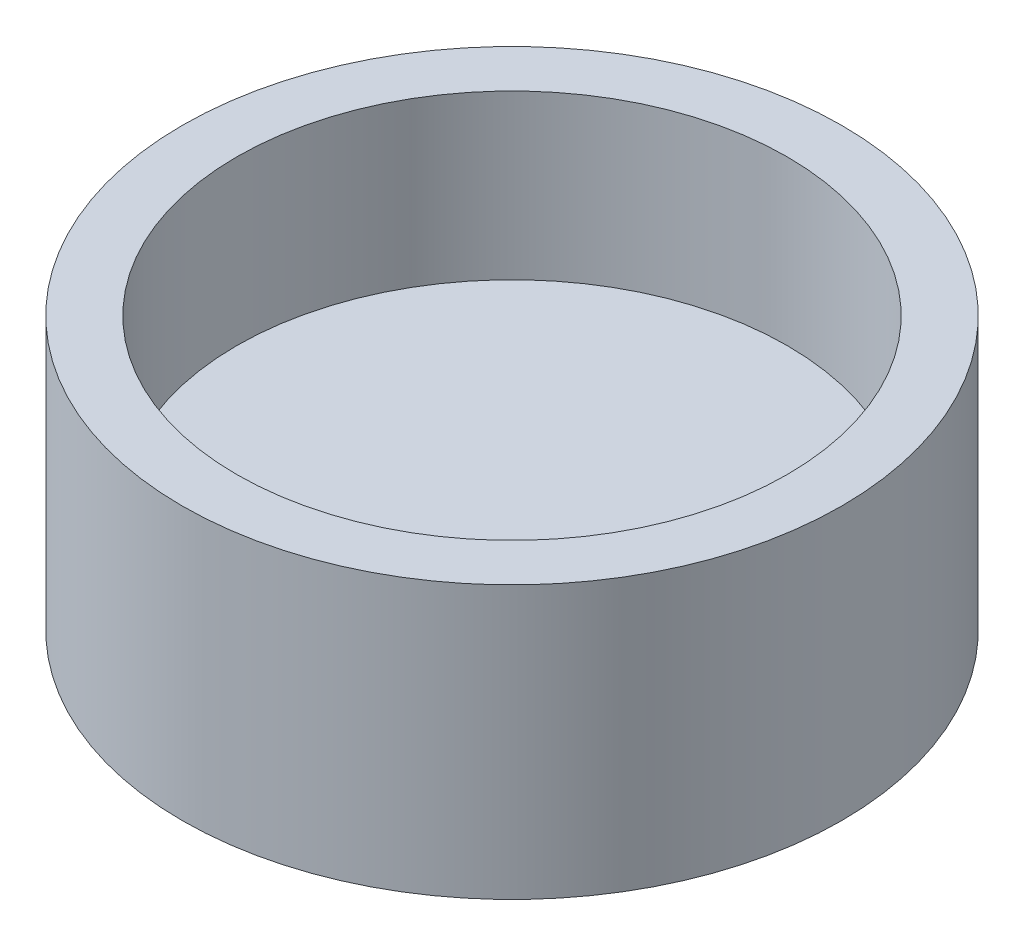
from build123d import *

# Parameters (mm, degrees)
SKETCH_1_R          = 6.05
EXTRUDE_1_DEPTH     = 5
SKETCH_2_R          = 5.05
CUT_EXTRUDE_1_DEPTH = 3


with BuildPart() as part:
    # 草图1 → 凸台-拉伸1 (new body)
    with BuildSketch(Plane(origin=(0, 0, 0), x_dir=(1, 0, 0), z_dir=(0, 1, 0))):
        with Locations(Location((0, 0, 0), (0, 0, 270))):
            Circle(SKETCH_1_R)
    extrude(amount=EXTRUDE_1_DEPTH)

    # 草图2 → 切除-拉伸1 (cut)
    with BuildSketch(Plane(origin=(0, 5, 0), x_dir=(1, 0, 0), z_dir=(0, 1, 0))):
        with Locations(Location((0, 0, 0), (0, 0, 270))):
            Circle(SKETCH_2_R)
    extrude(amount=-CUT_EXTRUDE_1_DEPTH, mode=Mode.SUBTRACT)


solid = part.part
